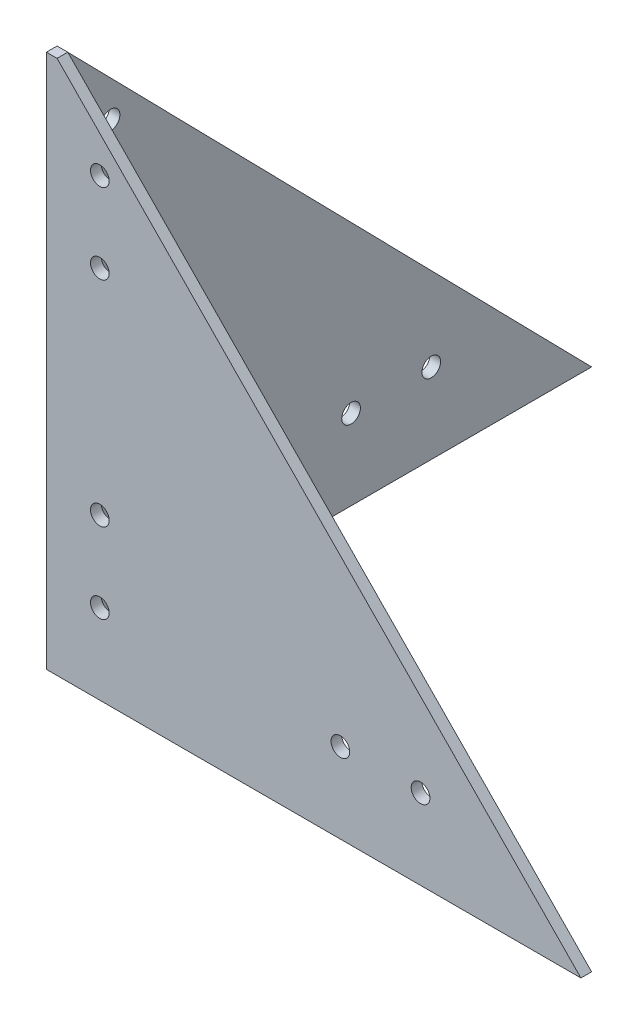
from build123d import *

# Parameters (mm, degrees)
ESBO_O1_W                = 2
ESBO_O1_H                = 2
RESSALTO_EXTRUS_O1_DEPTH = 100
RESSALTO_EXTRUS_O2_DEPTH = 2
RESSALTO_EXTRUS_O3_DEPTH = 2
ESBO_O4_R                = 1.75
CORTE_EXTRUS_O1_DEPTH    = 2
ESBO_O5_R                = 1.75
CORTE_EXTRUS_O2_DEPTH    = 2


with BuildPart() as part:
    # Esboço1 → Ressalto-extrusão1 (new body)
    with BuildSketch(Plane(origin=(0, 0, 0), x_dir=(1, 0, 0), z_dir=(0, 1, 0))):
        with Locations((1, 1)):
            Rectangle(ESBO_O1_W, ESBO_O1_H)
    extrude(amount=RESSALTO_EXTRUS_O1_DEPTH)

    # Esboço2 → Ressalto-extrusão2 (add)
    with BuildSketch(Plane.XY):
        Polygon((2, 0), (100, 0), (2, 100), align=None)
    extrude(amount=-RESSALTO_EXTRUS_O2_DEPTH)

    # Esboço3 → Ressalto-extrusão3 (add)
    with BuildSketch(Plane.ZY):
        Polygon((-2, 0), (-2, 100), (-100, 0), align=None)
    extrude(amount=-RESSALTO_EXTRUS_O3_DEPTH)

    # Esboço4 → Corte-extrusão1 (cut)
    with BuildSketch(Plane.ZY):
        with Locations((-10, 15)):
            Circle(ESBO_O4_R)
        with Locations((-10, 30)):
            Circle(ESBO_O4_R)
        with Locations((-10, 85)):
            Circle(ESBO_O4_R)
        with Locations((-10, 70)):
            Circle(ESBO_O4_R)
        with Locations((-55, 15)):
            Circle(ESBO_O4_R)
        with Locations((-70, 15)):
            Circle(ESBO_O4_R)
    extrude(amount=-CORTE_EXTRUS_O1_DEPTH, mode=Mode.SUBTRACT)

    # Esboço5 → Corte-extrusão2 (cut)
    with BuildSketch(Plane.XY):
        with Locations((10, 15)):
            Circle(ESBO_O5_R)
        with Locations((10, 30)):
            Circle(ESBO_O5_R)
        with Locations((10, 85)):
            Circle(ESBO_O5_R)
        with Locations((10, 70)):
            Circle(ESBO_O5_R)
        with Locations((70, 15)):
            Circle(ESBO_O5_R)
        with Locations((55, 15)):
            Circle(ESBO_O5_R)
    extrude(amount=-CORTE_EXTRUS_O2_DEPTH, mode=Mode.SUBTRACT)


solid = part.part
